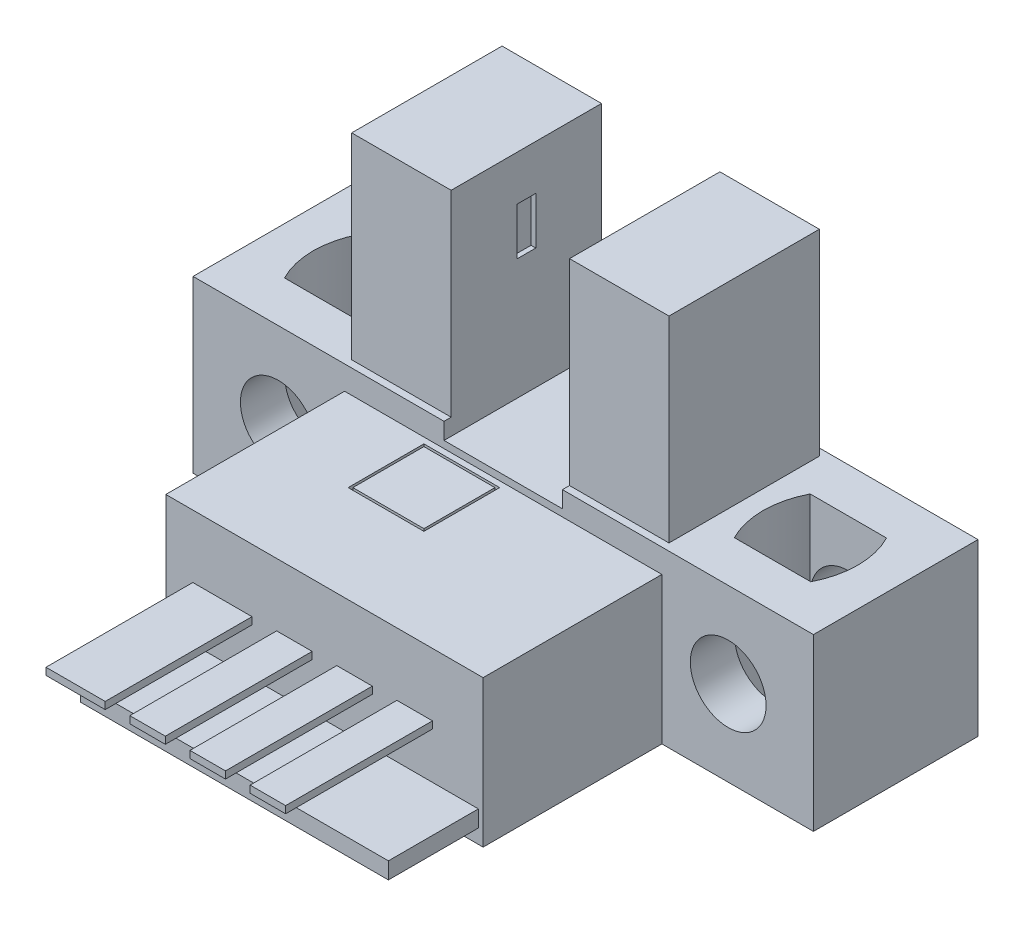
from build123d import *

# Parameters (mm, degrees)
SKETCH1_W                      = 26.2
SKETCH1_H                      = 7.2
BOSS_EXTRUDE1_DEPTH            = 6.95
SKETCH2_W                      = 5
SKETCH2_H                      = 0.7
CUT_EXTRUDE1_DEPTH             = 24.916991868
CUT_EXTRUDE2_DEPTH             = 25.716441896
CUT_EXTRUDE3_DEPTH             = 25.716441896
SKETCH5_W                      = 13.4
SKETCH5_H                      = 6.2
BOSS_EXTRUDE2_DEPTH            = 7.55
SKETCH6_W                      = 13
SKETCH6_H                      = 0.7
BOSS_EXTRUDE3_DEPTH            = 3.8
SKETCH7_W                      = 1.5
SKETCH7_H                      = 0.3
BOSS_EXTRUDE4_DEPTH            = 6.2
SKETCH8_W                      = 1.5
SKETCH8_H                      = 0.3
BOSS_EXTRUDE5_DEPTH            = 6.2
SKETCH9_W                      = 1.5
SKETCH9_H                      = 0.3
BOSS_EXTRUDE6_DEPTH            = 6.2
SKETCH10_W                     = 2.5
SKETCH10_H                     = 0.3
BOSS_EXTRUDE7_DEPTH            = 6.2
SKETCH11_W                     = 3.2
SKETCH11_H                     = 3.2
CUT_EXTRUDE4_DEPTH             = 1
SKETCH12_W                     = 3
SKETCH12_H                     = 3
BOSS_EXTRUDE8_DEPTH            = 1
SKETCH13_W                     = 4.2
SKETCH13_H                     = 6.35
BOSS_EXTRUDE9_DEPTH            = 8.3
SKETCH14_W                     = 0.8
SKETCH14_H                     = 2
CUT_EXTRUDE5_DEPTH             = 0.2
SKETCH15_W                     = 4.2
SKETCH15_H                     = 6.35
BOSS_EXTRUDE10_DEPTH           = 8.3
SKETCH16_W                     = 0.8
SKETCH16_H                     = 2
CUT_EXTRUDE6_DEPTH             = 0.2
F_3_2_3_2_DIAMETER_HOLE1_D     = 3.2
F_3_2_3_2_DIAMETER_HOLE1_DEPTH = 1.875
F_3_2_3_2_DIAMETER_HOLE2_D     = 3.2
F_3_2_3_2_DIAMETER_HOLE2_DEPTH = 6.95


with BuildPart() as part:
    # Sketch1 → Boss-Extrude1 (new body)
    with BuildSketch(Plane.XY.offset(6.95)):
        with Locations((9.5, 0)):
            Rectangle(SKETCH1_W, SKETCH1_H)
    extrude(amount=-BOSS_EXTRUDE1_DEPTH)

    # Sketch2 → Cut-Extrude1 (cut, through all)
    with BuildSketch(Plane(origin=(0, 0, 0), x_dir=(-1, 0, 0), z_dir=(0, 0, -1))):
        with Locations((-9.5, 3.25)):
            Rectangle(SKETCH2_W, SKETCH2_H)
    extrude(amount=-CUT_EXTRUDE1_DEPTH, mode=Mode.SUBTRACT)

    # Sketch3 → Cut-Extrude2 (cut, through all)
    with BuildSketch(Plane.XZ.offset(3.6)):
        with BuildLine():
            Line((1.612876483, 5.075), (-1.612876483, 5.075))
            ThreePointArc((-1.612876483, 5.075), (-2, 3.475), (-1.612876483, 1.875))
            Line((-1.612876483, 1.875), (1.612876483, 1.875))
            ThreePointArc((1.612876483, 1.875), (2, 3.475), (1.612876483, 5.075))
        make_face()
    extrude(amount=-CUT_EXTRUDE2_DEPTH, mode=Mode.SUBTRACT)

    # Sketch4 → Cut-Extrude3 (cut, through all)
    with BuildSketch(Plane.XZ.offset(3.6)):
        with BuildLine():
            Line((17.387123517, 1.875), (20.612876483, 1.875))
            ThreePointArc((20.612876483, 1.875), (21, 3.475), (20.612876483, 5.075))
            Line((20.612876483, 5.075), (17.387123517, 5.075))
            ThreePointArc((17.387123517, 5.075), (17, 3.475), (17.387123517, 1.875))
        make_face()
    extrude(amount=-CUT_EXTRUDE3_DEPTH, mode=Mode.SUBTRACT)

    # Sketch5 → Boss-Extrude2 (add)
    with BuildSketch(Plane.XY.offset(6.95)):
        with Locations((9.5, -0.5)):
            Rectangle(SKETCH5_W, SKETCH5_H)
    extrude(amount=BOSS_EXTRUDE2_DEPTH)

    # Sketch6 → Boss-Extrude3 (add)
    with BuildSketch(Plane.XY.offset(14.5)):
        with Locations((9.5, -2.65)):
            Rectangle(SKETCH6_W, SKETCH6_H)
    extrude(amount=BOSS_EXTRUDE3_DEPTH)

    # Sketch7 → Boss-Extrude4 (add)
    with BuildSketch(Plane.XY.offset(14.5)):
        with Locations((13.31, -0.2)):
            Rectangle(SKETCH7_W, SKETCH7_H)
    extrude(amount=BOSS_EXTRUDE4_DEPTH)

    # Sketch8 → Boss-Extrude5 (add)
    with BuildSketch(Plane.XY.offset(14.5)):
        with Locations((10.77, -0.2)):
            Rectangle(SKETCH8_W, SKETCH8_H)
    extrude(amount=BOSS_EXTRUDE5_DEPTH)

    # Sketch9 → Boss-Extrude6 (add)
    with BuildSketch(Plane.XY.offset(14.5)):
        with Locations((8.23, -0.2)):
            Rectangle(SKETCH9_W, SKETCH9_H)
    extrude(amount=BOSS_EXTRUDE6_DEPTH)

    # Sketch10 → Boss-Extrude7 (add)
    with BuildSketch(Plane.XY.offset(14.5)):
        with Locations((5.19, -0.2)):
            Rectangle(SKETCH10_W, SKETCH10_H)
    extrude(amount=BOSS_EXTRUDE7_DEPTH)

    # Sketch11 → Cut-Extrude4 (cut)
    with BuildSketch(Plane(origin=(0, 2.6, 0), x_dir=(-1, 0, 0), z_dir=(0, 1, 0))):
        with Locations((-8, 8.8)):
            Rectangle(SKETCH11_W, SKETCH11_H)
    extrude(amount=-CUT_EXTRUDE4_DEPTH, mode=Mode.SUBTRACT)

    # Sketch12 → Boss-Extrude8 (add)
    with BuildSketch(Plane(origin=(0, 1.6, 0), x_dir=(-1, 0, 0), z_dir=(0, 1, 0))):
        with Locations((-8, 8.8)):
            Rectangle(SKETCH12_W, SKETCH12_H)
    extrude(amount=BOSS_EXTRUDE8_DEPTH)

    # Sketch13 → Boss-Extrude9 (add)
    with BuildSketch(Plane(origin=(0, 3.6, 0), x_dir=(-1, 0, 0), z_dir=(0, 1, 0))):
        with Locations((-14.1, 3.475)):
            Rectangle(SKETCH13_W, SKETCH13_H)
    extrude(amount=BOSS_EXTRUDE9_DEPTH)

    # Sketch14 → Cut-Extrude5 (cut)
    with BuildSketch(Plane.ZY.offset(-12)):
        with Locations((3.475, 9)):
            Rectangle(SKETCH14_W, SKETCH14_H)
    extrude(amount=-CUT_EXTRUDE5_DEPTH, mode=Mode.SUBTRACT)

    # Sketch15 → Boss-Extrude10 (add)
    with BuildSketch(Plane(origin=(0, 3.6, 0), x_dir=(-1, 0, 0), z_dir=(0, 1, 0))):
        with Locations((-4.9, 3.475)):
            Rectangle(SKETCH15_W, SKETCH15_H)
    extrude(amount=BOSS_EXTRUDE10_DEPTH)

    # Sketch16 → Cut-Extrude6 (cut)
    with BuildSketch(Plane(origin=(7, 0, 0), x_dir=(0, 0, -1), z_dir=(1, 0, 0))):
        with Locations((-3.475, 9)):
            Rectangle(SKETCH16_W, SKETCH16_H)
    extrude(amount=-CUT_EXTRUDE6_DEPTH, mode=Mode.SUBTRACT)

    # Ø3.2 (3.2) Diameter Hole1
    with Locations(Plane(origin=(0, 0, 0), x_dir=(-1, 0, 0), z_dir=(0, 0, -1))):
        with Locations((0, 0), (-19, 0)):
            Hole(F_3_2_3_2_DIAMETER_HOLE1_D / 2, depth=F_3_2_3_2_DIAMETER_HOLE1_DEPTH)

    # Ø3.2 (3.2) Diameter Hole2
    with Locations(Plane.XY.offset(6.95)):
        with Locations((19, 0), (0, 0)):
            Hole(F_3_2_3_2_DIAMETER_HOLE2_D / 2, depth=F_3_2_3_2_DIAMETER_HOLE2_DEPTH)


solid = part.part
